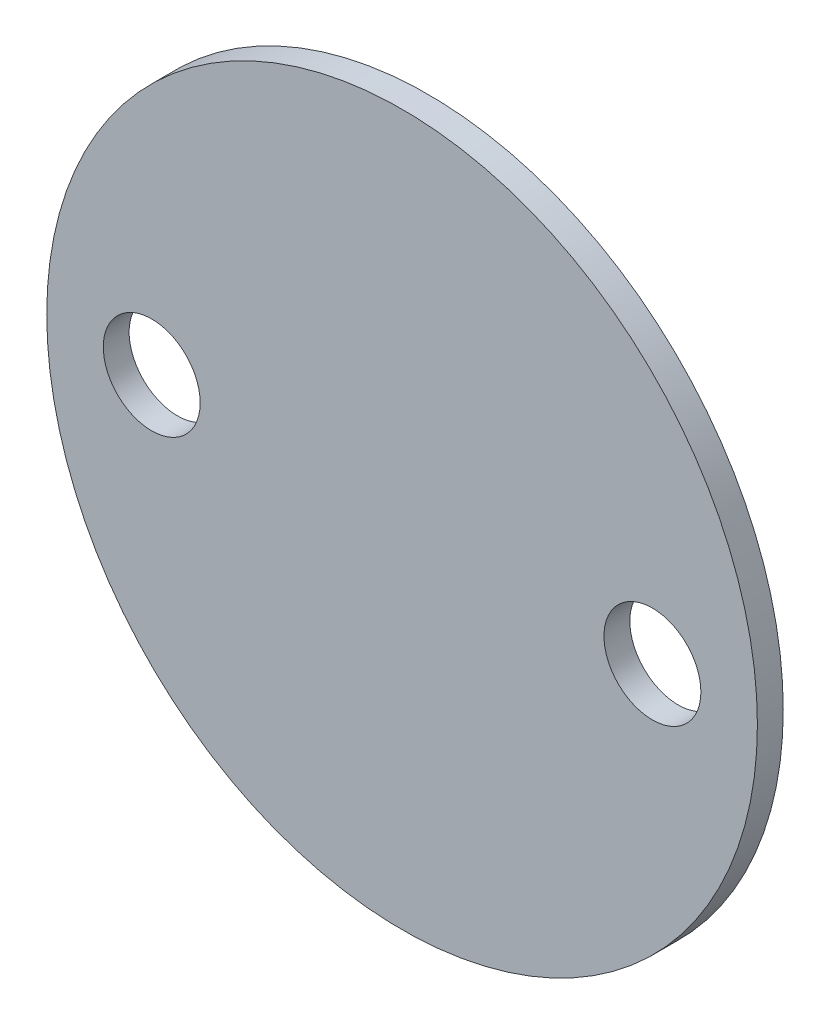
from build123d import *

# Parameters (mm, degrees)
ESQUISSE1_R        = 11
ESQUISSE1_R_2      = 1.5
BOSS_EXTRU_1_DEPTH = 0.8


with BuildPart() as part:
    # Esquisse1 → Boss.-Extru.1 (new body)
    with BuildSketch(Plane.XY):
        with Locations((-7.853526334, 0)):
            Circle(ESQUISSE1_R)
        with Locations((-15.603526334, 0)):
            Circle(ESQUISSE1_R_2, mode=Mode.SUBTRACT)
        with Locations((-0.103526334, 0)):
            Circle(ESQUISSE1_R_2, mode=Mode.SUBTRACT)
    extrude(amount=BOSS_EXTRU_1_DEPTH)


solid = part.part
